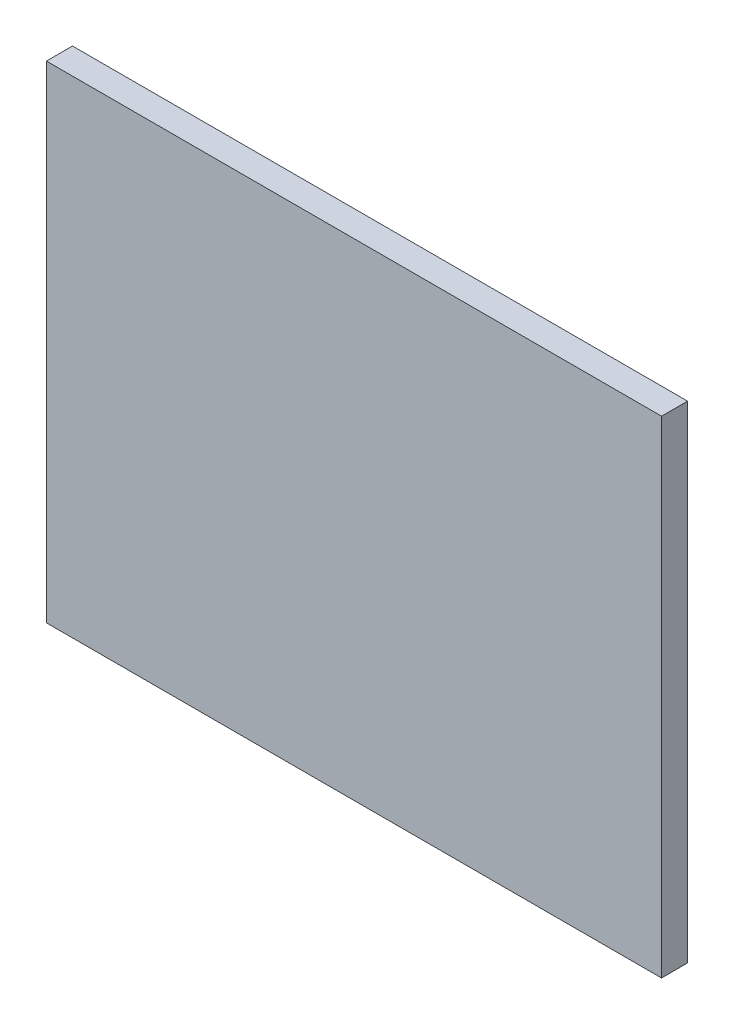
from build123d import *

# Parameters (mm, degrees)
ESQUISSE1_W        = 354
ESQUISSE1_H        = 280
BOSS_EXTRU_1_DEPTH = 15


with BuildPart() as part:
    # Esquisse1 → Boss.-Extru.1 (new body)
    with BuildSketch(Plane.XY):
        with Locations((177, 140)):
            Rectangle(ESQUISSE1_W, ESQUISSE1_H)
    extrude(amount=BOSS_EXTRU_1_DEPTH)


solid = part.part
